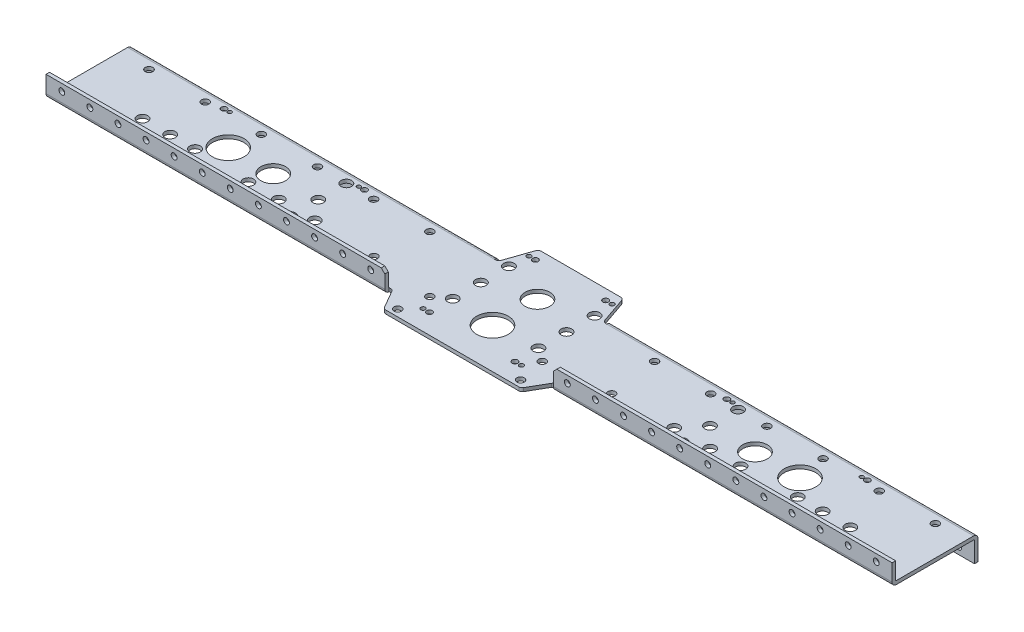
from build123d import *

# Parameters (mm, degrees)
SKETCH1_W                        = 355.6
SKETCH1_H                        = 77.724
BOSS_EXTRUDE1_DEPTH              = 22.225
SKETCH2_W                        = 74.549
SKETCH2_H                        = 19.05
CUT_EXTRUDE1_DEPTH               = 364.67400769
SKETCH3_W                        = 25.4
SKETCH3_H                        = 3.937
CUT_EXTRUDE2_DEPTH               = 817.364663535
SKETCH4_W                        = 330.2
SKETCH4_H                        = 3.175
BOSS_EXTRUDE2_DEPTH              = 15.875
SKETCH5_W                        = 69.85
SKETCH5_H                        = 3.175
BOSS_EXTRUDE3_DEPTH              = 457.2
SKETCH6_W                        = 330.2
SKETCH6_H                        = 3.175
BOSS_EXTRUDE4_DEPTH              = 3.937
SKETCH7_W                        = 330.2
SKETCH7_H                        = 3.175
BOSS_EXTRUDE5_DEPTH              = 15.875
SKETCH8_W                        = 355.6
SKETCH8_H                        = 3.175
BOSS_EXTRUDE6_DEPTH              = 3.937
SKETCH9_W                        = 355.6
SKETCH9_H                        = 3.175
BOSS_EXTRUDE7_DEPTH              = 19.05
SKETCH10_W                       = 124.052954744
SKETCH10_H                       = 3.175
BOSS_EXTRUDE8_DEPTH              = 19.05
SKETCH11_W                       = 76.358809824
SKETCH11_H                       = 3.175
BOSS_EXTRUDE9_DEPTH              = 27.432
DRAFT1_ANGLE                     = 30
DRAFT2_ANGLE                     = 19
F_6_CLEARANCE_HOLE1_D            = 4.064
F_6_CLEARANCE_HOLE1_DEPTH        = 19.05
HOLE1_D                          = 28.575
HOLE1_DEPTH                      = 19.05
F_7_8_0_875_DIAMETER_HOLE1_D     = 22.225
F_7_8_0_875_DIAMETER_HOLE1_DEPTH = 19.05
F_3_8_0_375_DIAMETER_HOLE1_D     = 9.525
F_3_8_0_375_DIAMETER_HOLE1_DEPTH = 19.05
F_5_CLEARANCE_HOLE1_D            = 3.571875
F_5_CLEARANCE_HOLE1_DEPTH        = 19.05
F_7_0_201_DIAMETER_HOLE1_D       = 5.1054
F_7_0_201_DIAMETER_HOLE1_DEPTH   = 19.05
H_0_266_DIAMETER_HOLE1_D         = 6.7564
H_0_266_DIAMETER_HOLE1_DEPTH     = 19.05
F_10_CLEARANCE_HOLE1_D           = 5.334
F_10_CLEARANCE_HOLE1_DEPTH       = 101.219
F_10_CLEARANCE_HOLE2_D           = 5.334
F_10_CLEARANCE_HOLE2_DEPTH       = 26.67
CHAMFER1_SIZE                    = 3.175
FILLET1_R                        = 0.762
FILLET2_R                        = 3.175
FILLET3_R                        = 3.937
CUT_EXTRUDE3_REACH               = 820.823
SKETCH30_W                       = 23.8125
SKETCH30_H                       = 77.724
CUT_EXTRUDE3_DIRECTION_2_REACH   = 820.823


with BuildPart() as part:
    # Sketch1 → Boss-Extrude1 (new body)
    with BuildSketch(Plane(origin=(0, 3.175, 0), x_dir=(1, 0, 0), z_dir=(0, 1, 0))):
        with Locations((635, 34.925)):
            Rectangle(SKETCH1_W, SKETCH1_H)
    extrude(amount=-BOSS_EXTRUDE1_DEPTH)

    # Sketch2 → Cut-Extrude1 (cut, through all)
    with BuildSketch(Plane(origin=(812.8, 0, 0), x_dir=(0, 0, -1), z_dir=(1, 0, 0))):
        with Locations((33.3375, -9.525)):
            Rectangle(SKETCH2_W, SKETCH2_H)
    extrude(amount=-CUT_EXTRUDE1_DEPTH, mode=Mode.SUBTRACT)

    # Sketch3 → Cut-Extrude2 (cut, through all)
    with BuildSketch(Plane.XZ):
        with Locations((469.9, 1.9685)):
            Rectangle(SKETCH3_W, SKETCH3_H)
    extrude(amount=-CUT_EXTRUDE2_DEPTH, mode=Mode.SUBTRACT)

    # Sketch4 → Boss-Extrude2 (add)
    with BuildSketch(Plane(origin=(0, 3.175, 0), x_dir=(-1, 0, 0), z_dir=(0, 1, 0))):
        with Locations((-647.7, 2.3495)):
            Rectangle(SKETCH4_W, SKETCH4_H)
    extrude(amount=BOSS_EXTRUDE2_DEPTH)

    # Sketch5 → Boss-Extrude3 (add)
    with BuildSketch(Plane.ZY.offset(-457.2)):
        with Locations((-34.925, 1.5875)):
            Rectangle(SKETCH5_W, SKETCH5_H)
    extrude(amount=BOSS_EXTRUDE3_DEPTH)

    # Sketch6 → Boss-Extrude4 (add)
    with BuildSketch(Plane.XY):
        with Locations((165.1, 1.5875)):
            Rectangle(SKETCH6_W, SKETCH6_H)
    extrude(amount=BOSS_EXTRUDE4_DEPTH)

    # Sketch7 → Boss-Extrude5 (add)
    with BuildSketch(Plane(origin=(0, 3.175, 0), x_dir=(-1, 0, 0), z_dir=(0, 1, 0))):
        with Locations((-165.1, 2.3495)):
            Rectangle(SKETCH7_W, SKETCH7_H)
    extrude(amount=BOSS_EXTRUDE5_DEPTH)

    # Sketch8 → Boss-Extrude6 (add)
    with BuildSketch(Plane(origin=(0, 0, -69.85), x_dir=(-1, 0, 0), z_dir=(0, 0, -1))):
        with Locations((-177.8, 1.5875)):
            Rectangle(SKETCH8_W, SKETCH8_H)
    extrude(amount=BOSS_EXTRUDE6_DEPTH)

    # Sketch9 → Boss-Extrude7 (add)
    with BuildSketch(Plane.XZ):
        with Locations((177.8, -72.1995)):
            Rectangle(SKETCH9_W, SKETCH9_H)
    extrude(amount=BOSS_EXTRUDE7_DEPTH)

    # Sketch10 → Boss-Extrude8 (add)
    with BuildSketch(Plane.XY):
        with Locations((406.4, 1.5875)):
            Rectangle(SKETCH10_W, SKETCH10_H)
    extrude(amount=BOSS_EXTRUDE8_DEPTH)

    # Sketch11 → Boss-Extrude9 (add)
    with BuildSketch(Plane(origin=(0, 0, -69.85), x_dir=(-1, 0, 0), z_dir=(0, 0, -1))):
        with Locations((-406.4, 1.5875)):
            Rectangle(SKETCH11_W, SKETCH11_H)
    extrude(amount=BOSS_EXTRUDE9_DEPTH)

    # Draft1
    draft1_faces = [part.faces().sort_by_distance(p)[0] for p in [
        (344.373522628, 1.5875, 9.525),
        (468.426477372, 1.5875, 9.525),
    ]]
    draft(draft1_faces, Plane.XY.offset(19.05), DRAFT1_ANGLE)

    # Draft2
    draft2_faces = [part.faces().sort_by_distance(p)[0] for p in [
        (368.220595088, 1.5875, -83.566),
        (444.579404912, 1.5875, -83.566),
    ]]
    draft(draft2_faces, Plane(origin=(0, 0, -97.282), x_dir=(-1, 0, 0), z_dir=(0, 0, -1)), DRAFT2_ANGLE)

    # #6 Clearance Hole1
    with Locations(Plane(origin=(0, 0, 0), x_dir=(-1, 0, 0), z_dir=(0, -1, 0))):
        with Locations((-450.8881, -1.03886), (-361.9119, -1.03886), (-368.808, 87.85352), (-443.992, 87.85352)):
            Hole(F_6_CLEARANCE_HOLE1_D / 2, depth=F_6_CLEARANCE_HOLE1_DEPTH)

    # Hole1
    with Locations(Plane(origin=(0, 0, 0), x_dir=(-1, 0, 0), z_dir=(0, -1, 0))):
        with Locations((-147.829162832, 36.83), (-406.4, 17.272), (-664.970837168, 36.83)):
            Hole(HOLE1_D / 2, depth=HOLE1_DEPTH)

    # 7/8 (0.875) Diameter Hole1
    with Locations(Plane(origin=(0, 0, 0), x_dir=(-1, 0, 0), z_dir=(0, -1, 0))):
        with Locations((-188.545362832, 36.83), (-406.4, 57.9628), (-624.254637168, 36.83)):
            Hole(F_7_8_0_875_DIAMETER_HOLE1_D / 2, depth=F_7_8_0_875_DIAMETER_HOLE1_DEPTH)

    # 3/8 (0.375) Diameter Hole1
    with Locations(Plane(origin=(0, 0, 0), x_dir=(-1, 0, 0), z_dir=(0, -1, 0))):
        with Locations((-229.261562832, 11.43), (-229.261562832, 62.23), (-229.261562832, 36.83), (-367.67570279, 70.866), (-367.67570279, 20.066), (-445.12429721, 20.066), (-445.12429721, 70.866), (-367.67570279, 45.466), (-445.12429721, 45.466), (-628.947697627, 19.05), (-601.438495912, 19.05), (-568.924874752, 19.05), (-243.875125248, 19.05), (-211.361504088, 19.05), (-183.852302373, 19.05), (-678.944202666, 20.828), (-701.450372003, 20.828), (-726.460886343, 20.828), (-133.855797334, 20.828), (-111.349627997, 20.828), (-86.339113657, 20.828), (-583.538437168, 62.23), (-583.538437168, 36.83), (-583.538437168, 11.43)):
            Hole(F_3_8_0_375_DIAMETER_HOLE1_D / 2, depth=F_3_8_0_375_DIAMETER_HOLE1_DEPTH)

    # #5 Clearance Hole1
    with Locations(Plane(origin=(0, 0, 0), x_dir=(-1, 0, 0), z_dir=(0, -1, 0))):
        with Locations((-237.440362832, 65.405), (-237.440362832, 8.255), (-120.600362832, 8.255), (-120.600362832, 65.405), (-575.359637168, 65.405), (-575.359637168, 8.255), (-692.199637168, 65.405), (-692.199637168, 8.255)):
            Hole(F_5_CLEARANCE_HOLE1_D / 2, depth=F_5_CLEARANCE_HOLE1_DEPTH)

    # #7 (0.201) Diameter Hole1
    with Locations(Plane(origin=(0, 0, 0), x_dir=(-1, 0, 0), z_dir=(0, -1, 0))):
        with Locations((-242.520362832, 65.405), (-242.520362832, 8.255), (-115.520362832, 8.255), (-115.520362832, 65.405), (-367.7539, -1.03886), (-445.0461, -1.03886), (-374.65, 87.85352), (-438.15, 87.85352), (-570.279637168, 65.405), (-570.279637168, 8.255), (-697.279637168, 65.405), (-697.279637168, 8.255)):
            Hole(F_7_0_201_DIAMETER_HOLE1_D / 2, depth=F_7_0_201_DIAMETER_HOLE1_DEPTH)

    # H (0.266) Diameter Hole1
    with Locations(Plane(origin=(0, 0, 0), x_dir=(-1, 0, 0), z_dir=(0, -1, 0))):
        with Locations((-508, 62.23), (-558.8, 11.43), (-558.8, 62.23), (-609.6, 11.43), (-457.2, 11.43), (-355.6, 11.43), (-304.8, 62.23), (-254, 62.23), (-152.4, 11.43), (-101.6, 62.23), (-101.6, 11.43), (-50.8, 62.23), (-254, 11.43), (-203.2, 62.23), (-203.2, 11.43), (-152.4, 62.23), (-711.2, 62.23), (-762, 11.43), (-762, 62.23), (-609.6, 62.23), (-660.4, 11.43), (-660.4, 62.23), (-711.2, 11.43), (-50.8, 11.43), (-461.9625, -12.8905), (-350.8375, -12.8905), (-513.925467617, 17.547282407), (-298.874532383, 17.547282407)):
            Hole(H_0_266_DIAMETER_HOLE1_D / 2, depth=H_0_266_DIAMETER_HOLE1_DEPTH)

    # #10 Clearance Hole1
    with Locations(Plane.XY.offset(3.937)):
        with Locations((495.3, 12.7), (520.7, 12.7), (546.1, 12.7), (571.5, 12.7), (596.9, 12.7), (622.3, 12.7), (647.7, 12.7), (673.1, 12.7), (698.5, 12.7), (723.9, 12.7), (749.3, 12.7), (774.7, 12.7), (800.1, 12.7), (317.5, 12.7), (292.1, 12.7), (266.7, 12.7), (241.3, 12.7), (215.9, 12.7), (190.5, 12.7), (165.1, 12.7), (139.7, 12.7), (114.3, 12.7), (88.9, 12.7), (63.5, 12.7), (12.7, 12.7), (38.1, 12.7)):
            Hole(F_10_CLEARANCE_HOLE1_D / 2, depth=F_10_CLEARANCE_HOLE1_DEPTH)

    # #10 Clearance Hole2
    with Locations(Plane.XY.offset(-70.612)):
        with Locations((469.9, -12.7), (495.3, -12.7), (520.7, -12.7), (546.1, -12.7), (571.5, -12.7), (596.9, -12.7), (622.3, -12.7), (647.7, -12.7), (673.1, -12.7), (698.5, -12.7), (723.9, -12.7), (749.3, -12.7), (774.7, -12.7), (800.1, -12.7), (342.9, -12.7), (317.5, -12.7), (292.1, -12.7), (266.7, -12.7), (241.3, -12.7), (215.9, -12.7), (190.5, -12.7), (165.1, -12.7), (139.7, -12.7), (114.3, -12.7), (88.9, -12.7), (63.5, -12.7), (38.1, -12.7), (12.7, -12.7)):
            Hole(F_10_CLEARANCE_HOLE2_D / 2, depth=F_10_CLEARANCE_HOLE2_DEPTH)

    # Chamfer1
    chamfer1_edges = [part.edges().sort_by_distance(p)[0] for p in [
        (0, -19.05, -72.1995),
        (355.6, -19.05, -72.1995),
        (812.8, -19.05, -72.1995),
        (812.8, 19.05, 2.3495),
        (482.6, 19.05, 2.3495),
        (457.2, -19.05, -72.1995),
        (330.2, 19.05, 2.3495),
        (0, 19.05, 2.3495),
    ]]
    chamfer(chamfer1_edges, length=CHAMFER1_SIZE)

    # Fillet1
    fillet1_edges = [part.edges().sort_by_distance(p)[0] for p in [
        (635, 0, -70.612),
        (165.1, 3.175, 0.762),
        (647.7, 3.175, 0.762),
        (177.8, 0, -70.612),
    ]]
    fillet(fillet1_edges, radius=FILLET1_R)

    # Fillet2
    fillet2_edges = [part.edges().sort_by_distance(p)[0] for p in [
        (333.375, 1.5875, 0),
        (479.425, 1.5875, 0),
        (344.373522628, 1.5875, 19.05),
        (468.426477372, 1.5875, 19.05),
        (454.025, 1.5875, -69.85),
        (358.775, 1.5875, -69.85),
        (444.579404912, 1.5875, -97.282),
        (368.220595088, 1.5875, -97.282),
    ]]
    fillet(fillet2_edges, radius=FILLET2_R)

    # Fillet3
    fillet3_edges = [part.edges().sort_by_distance(p)[0] for p in [
        (177.8, 3.175, -73.787),
        (165.1, 0, 3.937),
        (647.7, 0, 3.937),
        (635, 3.175, -73.787),
    ]]
    fillet(fillet3_edges, radius=FILLET3_R)

    # Sketch30 → Cut-Extrude3 (cut, up to next)
    with BuildSketch(Plane(origin=(0, 0, 0), x_dir=(-1, 0, 0), z_dir=(0, -1, 0)), mode=Mode.PRIVATE) as cut_extrude3_sk1:
        with Locations((-11.90625, 34.925)):
            Rectangle(SKETCH30_W, SKETCH30_H)
    cut_extrude3_tool1 = extrude(cut_extrude3_sk1.sketch, amount=-CUT_EXTRUDE3_REACH, mode=Mode.PRIVATE) & part.part
    # Sketch30 → Cut-Extrude3 (cut, up to next)
    with BuildSketch(Plane(origin=(0, 0, 0), x_dir=(-1, 0, 0), z_dir=(0, -1, 0)), mode=Mode.PRIVATE) as cut_extrude3_sk2:
        with Locations((-800.89375, 34.925)):
            Rectangle(SKETCH30_W, SKETCH30_H)
    cut_extrude3_tool2 = extrude(cut_extrude3_sk2.sketch, amount=-CUT_EXTRUDE3_REACH, mode=Mode.PRIVATE) & part.part
    add(cut_extrude3_tool1.solids().sort_by_distance((11.90625, 0, -34.925))[0], mode=Mode.SUBTRACT)
    add(cut_extrude3_tool2.solids().sort_by_distance((800.89375, 0, -34.925))[0], mode=Mode.SUBTRACT)

    # Sketch30 → Cut-Extrude3 direction 2 (cut, up to next)
    with BuildSketch(Plane(origin=(0, 0, 0), x_dir=(-1, 0, 0), z_dir=(0, -1, 0)), mode=Mode.PRIVATE) as cut_extrude3_direction_2_sk1:
        with Locations((-11.90625, 34.925)):
            Rectangle(SKETCH30_W, SKETCH30_H)
    cut_extrude3_direction_2_tool1 = extrude(cut_extrude3_direction_2_sk1.sketch, amount=CUT_EXTRUDE3_DIRECTION_2_REACH, mode=Mode.PRIVATE) & part.part
    # Sketch30 → Cut-Extrude3 direction 2 (cut, up to next)
    with BuildSketch(Plane(origin=(0, 0, 0), x_dir=(-1, 0, 0), z_dir=(0, -1, 0)), mode=Mode.PRIVATE) as cut_extrude3_direction_2_sk2:
        with Locations((-800.89375, 34.925)):
            Rectangle(SKETCH30_W, SKETCH30_H)
    cut_extrude3_direction_2_tool2 = extrude(cut_extrude3_direction_2_sk2.sketch, amount=CUT_EXTRUDE3_DIRECTION_2_REACH, mode=Mode.PRIVATE) & part.part
    add(cut_extrude3_direction_2_tool1.solids().sort_by_distance((11.90625, 0, -34.925))[0], mode=Mode.SUBTRACT)
    add(cut_extrude3_direction_2_tool2.solids().sort_by_distance((800.89375, 0, -34.925))[0], mode=Mode.SUBTRACT)


solid = part.part
